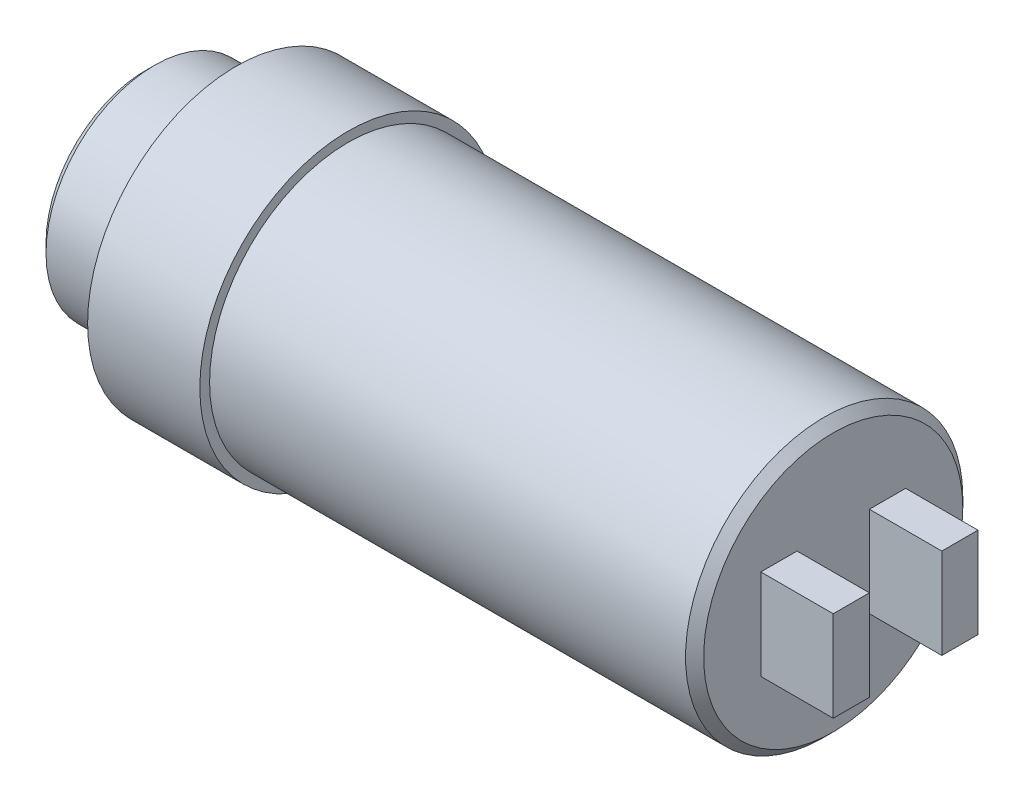
from build123d import *

# Parameters (mm, degrees)
SKETCH2_R           = 1.75
CUT_EXTRUDE1_DEPTH  = 17
SKETCH3_W           = 1
SKETCH3_H           = 2.5
BOSS_EXTRUDE1_DEPTH = 2
CHAMFER1_SIZE       = 0.25
BOSS_EXTRUDE2_START = -3.1
SKETCH5_R           = 4.10031535
SKETCH5_R_2         = 3.83
BOSS_EXTRUDE2_DEPTH = 3.1


with BuildPart() as part:
    # Sketch1 → Revolve1 (revolve)
    with BuildSketch(Plane(origin=(0, 0, 0), x_dir=(1, 0, 0), z_dir=(0, 1, 0))):
        Polygon((0, 0), (0, 3), (2.5, 3), (2.5, 3.83), (19, 3.83), (19, 0), align=None)
    revolve(axis=Axis((19, 0, 0), (-1, 0, 0)))

    # Sketch2 → Cut-Extrude1 (cut)
    with BuildSketch(Plane.ZY):
        Circle(SKETCH2_R)
    extrude(amount=-CUT_EXTRUDE1_DEPTH, mode=Mode.SUBTRACT)

    # Sketch3 → Boss-Extrude1 (add)
    with BuildSketch(Plane(origin=(19, 0, 0), x_dir=(0, 0, -1), z_dir=(1, 0, 0))):
        with Locations((-1.5, 0)):
            Rectangle(SKETCH3_W, SKETCH3_H)
        with Locations((1.5, 0)):
            Rectangle(SKETCH3_W, SKETCH3_H)
    extrude(amount=BOSS_EXTRUDE1_DEPTH)

    # Chamfer1
    chamfer1_edges = [part.edges().sort_by_distance(p)[0] for p in [
        (19, 0, 3.83),
        (0, 0, 3),
        (0, 0, -1.75),
    ]]
    chamfer(chamfer1_edges, length=CHAMFER1_SIZE)

    # Sketch5 → Boss-Extrude2 (add)
    with BuildSketch(Plane.ZY.offset(-2.5).offset(BOSS_EXTRUDE2_START)):
        Circle(SKETCH5_R)
        Circle(SKETCH5_R_2, mode=Mode.SUBTRACT)
    extrude(amount=BOSS_EXTRUDE2_DEPTH)


solid = part.part
